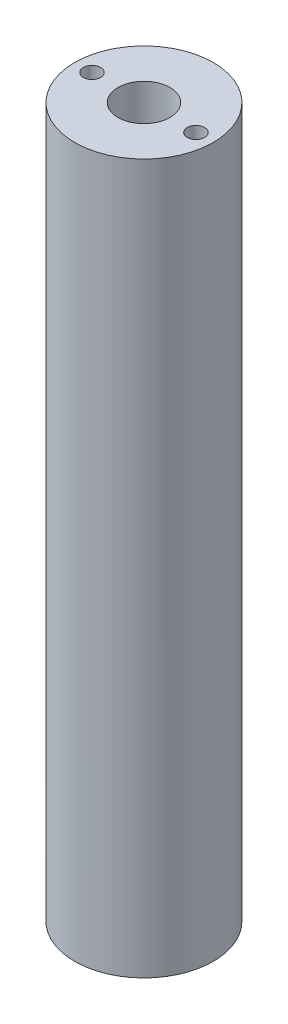
from build123d import *

# Parameters (mm, degrees)
SKETCH1_W               = 12.7
SKETCH1_H               = 259.938138032
SKETCH2_R               = 4.7625
CUT_EXTRUDE1_DEPTH      = 285.124126062
CUT_EXTRUDE2_DEPTH      = 339.459088986
CUT_EXTRUDE2_DEPTH_BACK = 339.459088986
SKETCH3_W               = 82.52004382
SKETCH3_H               = 140.871037148
SKETCH4_R               = 1.5875
CUT_EXTRUDE3_DEPTH      = 12.7
CUT_EXTRUDE4_START      = -12.7
SKETCH5_R               = 1.5875
CUT_EXTRUDE4_DEPTH      = 12.7


with BuildPart() as part:
    # Sketch1 → Revolve1 (revolve)
    with BuildSketch(Plane.XY):
        with Locations((94.956111271, 188.458114984)):
            Rectangle(SKETCH1_W, SKETCH1_H)
    revolve(axis=Axis((101.306111271, 318.427184, 0), (0, -1, 0)))

    # Sketch2 → Cut-Extrude1 (cut, through all)
    with BuildSketch(Plane(origin=(0, 318.427184, 0), x_dir=(1, 0, 0), z_dir=(0, 1, 0))):
        with Locations(Location((101.306111271, 0, 0), (0, 0, 180))):
            Circle(SKETCH2_R)
    extrude(amount=-CUT_EXTRUDE1_DEPTH, mode=Mode.SUBTRACT)

    # Sketch3 → Cut-Extrude2 (cut, two sides: drawn at the far end of the back side and taken through both)
    with BuildSketch(Plane.XY.offset(-CUT_EXTRUDE2_DEPTH_BACK)):
        with Locations((93.882760048, 258.893633558)):
            Rectangle(SKETCH3_W, SKETCH3_H)
    extrude(amount=CUT_EXTRUDE2_DEPTH + CUT_EXTRUDE2_DEPTH_BACK, mode=Mode.SUBTRACT)

    # Sketch4 → Cut-Extrude3 (cut)
    with BuildSketch(Plane(origin=(0, 188.458114984, 0), x_dir=(1, 0, 0), z_dir=(0, 1, 0))):
        with Locations(Location((91.781111271, 0, 0), (0, 0, 270))):
            Circle(SKETCH4_R)
        with Locations(Location((110.831111271, 0, 0), (0, 0, 270))):
            Circle(SKETCH4_R)
    extrude(amount=-CUT_EXTRUDE3_DEPTH, mode=Mode.SUBTRACT)

    # Sketch5 → Cut-Extrude4 (cut)
    with BuildSketch(Plane.XZ.offset(-58.489045968).offset(CUT_EXTRUDE4_START)):
        with Locations(Location((91.781111271, 0, 0), (0, 0, 90))):
            Circle(SKETCH5_R)
        with Locations(Location((110.831111271, 0, 0), (0, 0, 90))):
            Circle(SKETCH5_R)
    extrude(amount=CUT_EXTRUDE4_DEPTH, mode=Mode.SUBTRACT)


solid = part.part
